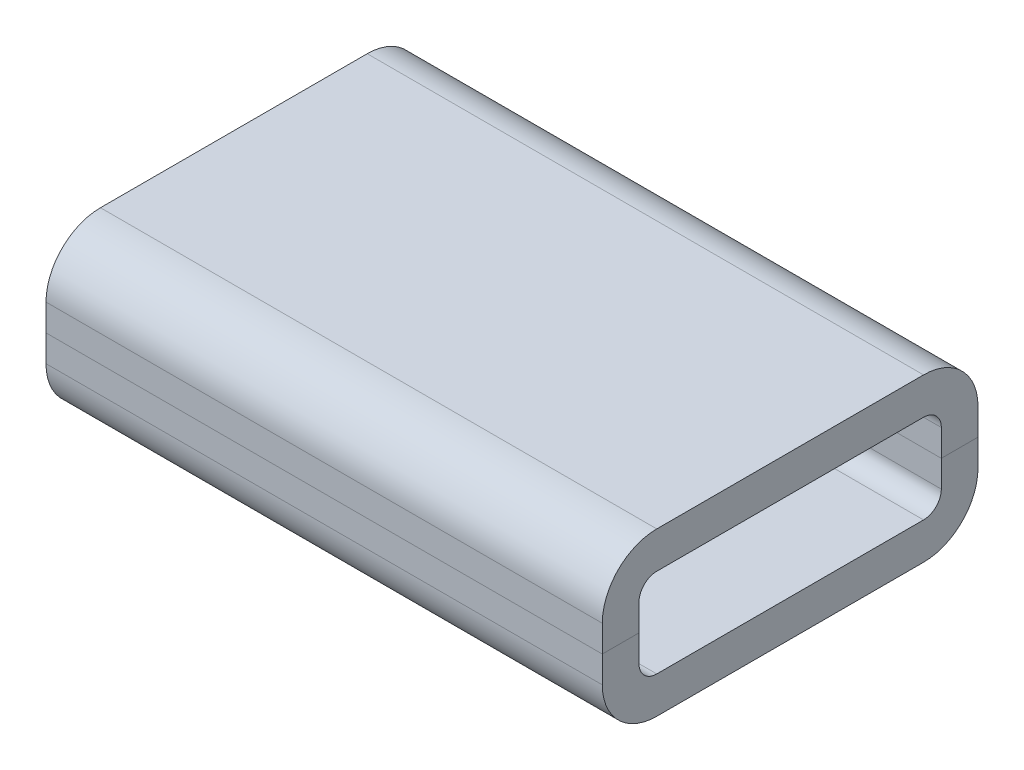
from build123d import *

# Parameters (mm, degrees)
BOSS_EXTRUDE1_DEPTH = 25.025


with BuildPart() as part:
    # Sketch1 → Boss-Extrude1 (new, symmetric)
    with BuildSketch(Plane(origin=(0, 0, 0), x_dir=(0, 0, -1), z_dir=(1, 0, 0))):
        with BuildLine():
            Line((-13.6, 0), (-13.6, 2.4))
            ThreePointArc((-13.6, 2.4), (-13.13137085, 3.53137085), (-12, 4))
            Line((-12, 4), (12, 4))
            ThreePointArc((12, 4), (13.13137085, 3.53137085), (13.6, 2.4))
            Line((13.6, 2.4), (13.6, 0))
            Line((13.6, 0), (16.9, 0))
            Line((16.9, 0), (16.9, 2.4))
            ThreePointArc((16.9, 2.4), (15.464823228, 5.864823228), (12, 7.3))
            Line((12, 7.3), (-12, 7.3))
            ThreePointArc((-12, 7.3), (-15.464823228, 5.864823228), (-16.9, 2.4))
            Line((-16.9, 2.4), (-16.9, 0))
            Line((-16.9, 0), (-13.6, 0))
        make_face()
    extrude(amount=BOSS_EXTRUDE1_DEPTH, both=True)


with BuildPart() as body_2:
    # Mirror1: mirrored copy
    add(part.part.mirror(Plane.ZX))


solid = Compound([part.part, body_2.part])
